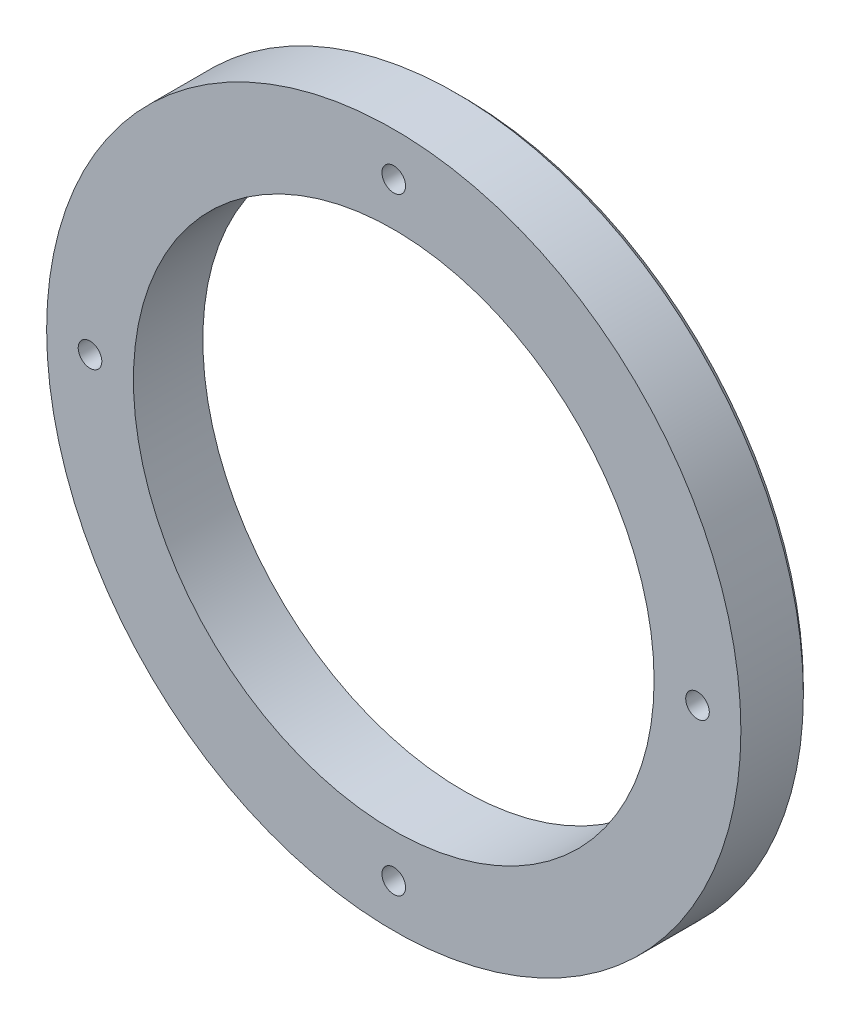
from build123d import *

# Parameters (mm, degrees)
SZKIC1_R                    = 100
SZKIC1_R_2                  = 75
SZKIC1_R_3                  = 3.4
DODANIE_WYCI_GNI_CIE1_DEPTH = 10
SFAZOWANIE1_SIZE            = 2


with BuildPart() as part:
    # Szkic1 → Dodanie-wyciągnięcie1 (new, symmetric)
    with BuildSketch(Plane.XY):
        Circle(SZKIC1_R)
        Circle(SZKIC1_R_2, mode=Mode.SUBTRACT)
        with Locations((0, 87.5)):
            Circle(SZKIC1_R_3, mode=Mode.SUBTRACT)
        with Locations((87.5, 0)):
            Circle(SZKIC1_R_3, mode=Mode.SUBTRACT)
        with Locations((0, -87.5)):
            Circle(SZKIC1_R_3, mode=Mode.SUBTRACT)
        with Locations((-87.5, 0)):
            Circle(SZKIC1_R_3, mode=Mode.SUBTRACT)
    extrude(amount=DODANIE_WYCI_GNI_CIE1_DEPTH, both=True)

    # Sfazowanie1
    sfazowanie1_edges = [part.edges().sort_by_distance(p)[0] for p in [
        (-100, 0, -10),
    ]]
    chamfer(sfazowanie1_edges, length=SFAZOWANIE1_SIZE)


solid = part.part
